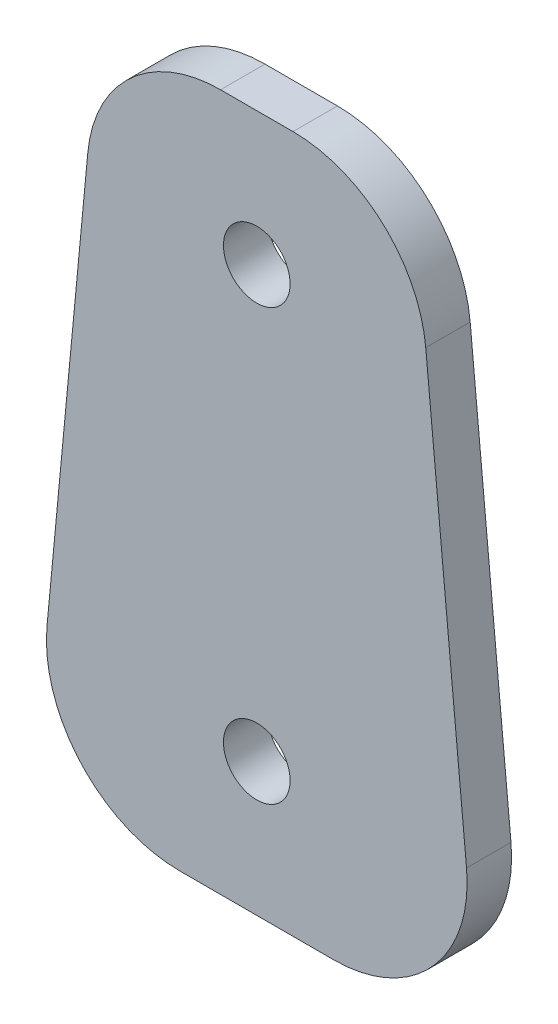
from build123d import *

# Parameters (mm, degrees)
SKETCH1_R           = 2.38125
BOSS_EXTRUDE1_DEPTH = 3.175


with BuildPart() as part:
    # Sketch1 → Boss-Extrude1 (new body)
    with BuildSketch(Plane.XY):
        with BuildLine():
            Line((38.796438037, 93.101198887), (35.882007002, 123.835198887))
            ThreePointArc((35.882007002, 123.835198887), (32.808943632, 129.981938348), (26.399546016, 132.461))
            Line((26.399546016, 132.461), (21.225453984, 132.461))
            ThreePointArc((21.225453984, 132.461), (14.816056368, 129.981938348), (11.742992998, 123.835198887))
            Line((11.742992998, 123.835198887), (8.828561963, 93.101198887))
            ThreePointArc((8.828561963, 93.101198887), (11.265084602, 85.792602384), (18.31102295, 82.677))
            Line((18.31102295, 82.677), (29.31397705, 82.677))
            ThreePointArc((29.31397705, 82.677), (36.359915398, 85.792602384), (38.796438037, 93.101198887))
        make_face()
        with Locations((23.8125, 92.202)):
            Circle(SKETCH1_R, mode=Mode.SUBTRACT)
        with Locations((23.8125, 122.936)):
            Circle(SKETCH1_R, mode=Mode.SUBTRACT)
    extrude(amount=BOSS_EXTRUDE1_DEPTH)


solid = part.part
